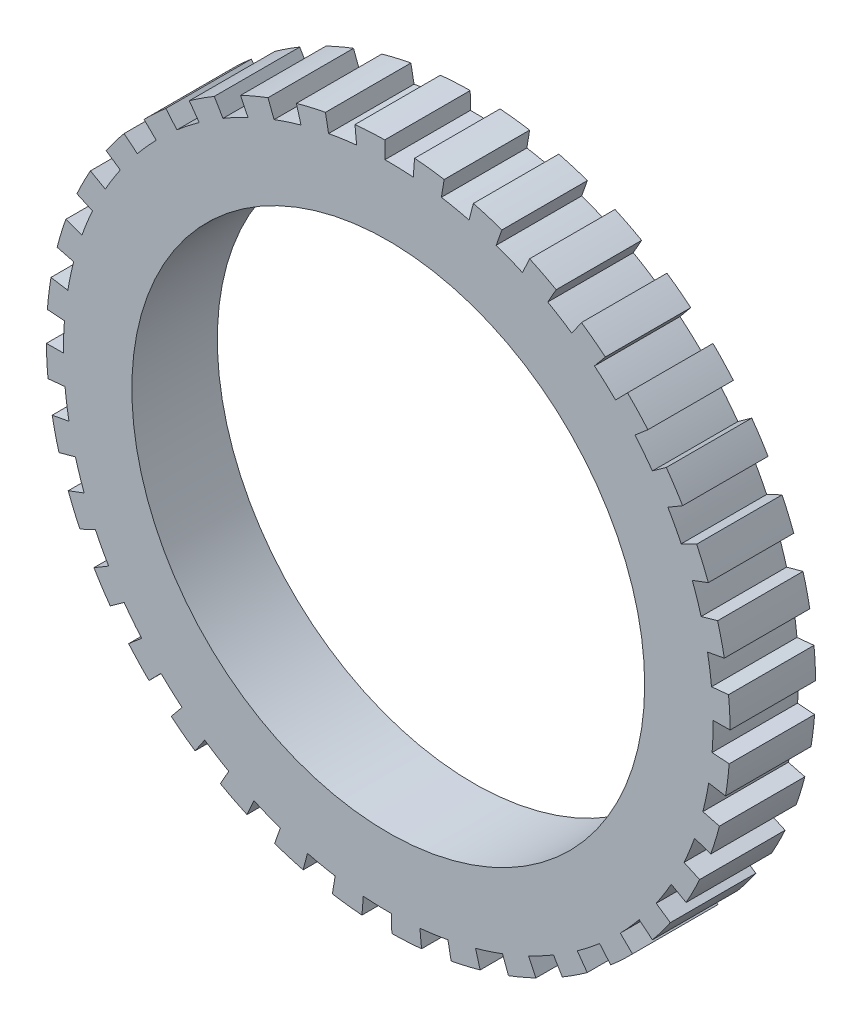
from build123d import *

# Parameters (mm, degrees)
SKETCH1_R           = 20
SKETCH1_R_2         = 15
BOSS_EXTRUDE1_DEPTH = 5
CUT_EXTRUDE1_START  = -5
CUT_EXTRUDE1_DEPTH  = 5
CIRPATTERN1_COUNT   = 36
SCALE1_SCALE        = 1.9329
SCALE2_SCALE        = 1.5


with BuildPart() as part:
    # Sketch1 → Boss-Extrude1 (new body)
    with BuildSketch(Plane.XY):
        Circle(SKETCH1_R)
        Circle(SKETCH1_R_2, mode=Mode.SUBTRACT)
    extrude(amount=BOSS_EXTRUDE1_DEPTH)

    # Sketch2 → Cut-Extrude1 (cut)
    with BuildSketch(Plane.XY.offset(5).offset(CUT_EXTRUDE1_START)):
        with BuildLine():
            Line((-18.744284369, 3.106735184), (-19.730825651, 3.270247562))
            ThreePointArc((-19.730825651, 3.270247562), (-19.569400082, 4.127781538), (-19.370723048, 4.977458047))
            Line((-19.370723048, 4.977458047), (-18.402186895, 4.728585145))
            ThreePointArc((-18.402186895, 4.728585145), (-18.590930078, 3.921392461), (-18.744284369, 3.106735184))
        make_face()
    cut_extrude1 = extrude(amount=CUT_EXTRUDE1_DEPTH, mode=Mode.SUBTRACT)

    # CirPattern1: Cut-Extrude1 ×36 about axis
    cirpattern1_axis = Axis((0, 0, 5), (0, 0, 1))
    for i in range(1, CIRPATTERN1_COUNT):
        add(cut_extrude1.rotate(cirpattern1_axis, i * 360 / CIRPATTERN1_COUNT), mode=Mode.SUBTRACT)


with BuildPart() as part_1:
    # Scale1: scaled about (0, 0, 2.5)
    add(part.part.scale(SCALE1_SCALE).moved(Location((0, 0, -2.33225))))


with BuildPart() as part_2:
    # Scale2: scaled about (0, 0, 2.5)
    add(part_1.part.scale(SCALE2_SCALE).moved(Location((0, 0, -1.25))))


solid = part_2.part
